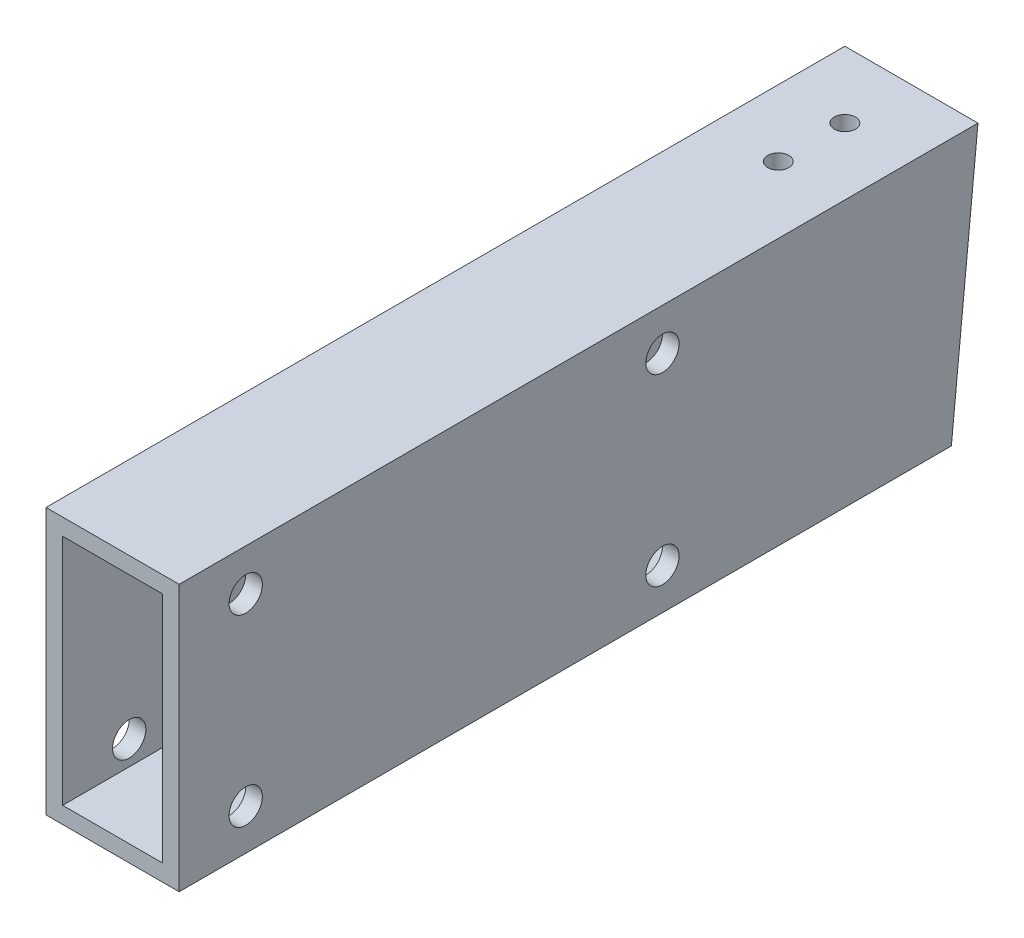
from build123d import *

# Parameters (mm, degrees)
SKETCH1_W                   = 25.4
SKETCH1_H                   = 50.8
BOSS_EXTRUDE1_DEPTH         = 76.2
F_1_4_0_25_DIAMETER_HOLE1_D = 6.35
F_10_32_TAPPED_HOLE1_D      = 4.0386
F_10_32_TAPPED_HOLE1_DEPTH  = 13.716
F_10_32_TAPPED_HOLE1_TIP    = 1.213317848
CUT_EXTRUDE1_DEPTH          = 85.242269675
SKETCH9_W                   = 19.05
SKETCH9_H                   = 44.45
CUT_EXTRUDE2_DEPTH          = 156.02325632


with BuildPart() as part:
    # Sketch1 → Boss-Extrude1 (new, symmetric)
    with BuildSketch(Plane.XY):
        Rectangle(SKETCH1_W, SKETCH1_H)
    extrude(amount=BOSS_EXTRUDE1_DEPTH, both=True)

    # 1/4 (0.25) Diameter Hole1 (through all)
    with Locations(Plane(origin=(12.7, 0, 0), x_dir=(0, 0, -1), z_dir=(1, 0, 0))):
        with Locations((-63.5, 17.4625), (16.002, 17.4625), (16.002, -17.5895), (-63.5, -17.5895)):
            Hole(F_1_4_0_25_DIAMETER_HOLE1_D / 2)

    # #10-32 Tapped Hole1
    with Locations(Plane(origin=(0, 25.4, 0), x_dir=(1, 0, 0), z_dir=(0, 1, 0))):
        with Locations((0, 63.5), (0, 50.8)):
            Hole(F_10_32_TAPPED_HOLE1_D / 2, depth=F_10_32_TAPPED_HOLE1_DEPTH)
            with Locations((0, 0, -(F_10_32_TAPPED_HOLE1_DEPTH + F_10_32_TAPPED_HOLE1_TIP / 2))):  # 118° drill point
                Cone(0, F_10_32_TAPPED_HOLE1_D / 2, F_10_32_TAPPED_HOLE1_TIP, mode=Mode.SUBTRACT)

    # Sketch8 → Cut-Extrude1 (cut, through all)
    with BuildSketch(Plane(origin=(12.7, 0, 0), x_dir=(0, 0, -1), z_dir=(1, 0, 0))):
        Polygon((76.2, 25.4), (71.12, -25.4), (76.2, -25.4), align=None)
    extrude(amount=-CUT_EXTRUDE1_DEPTH, mode=Mode.SUBTRACT)

    # Sketch9 → Cut-Extrude2 (cut, through all)
    with BuildSketch(Plane.XY.offset(76.2)):
        Rectangle(SKETCH9_W, SKETCH9_H)
    extrude(amount=-CUT_EXTRUDE2_DEPTH, mode=Mode.SUBTRACT)


solid = part.part
